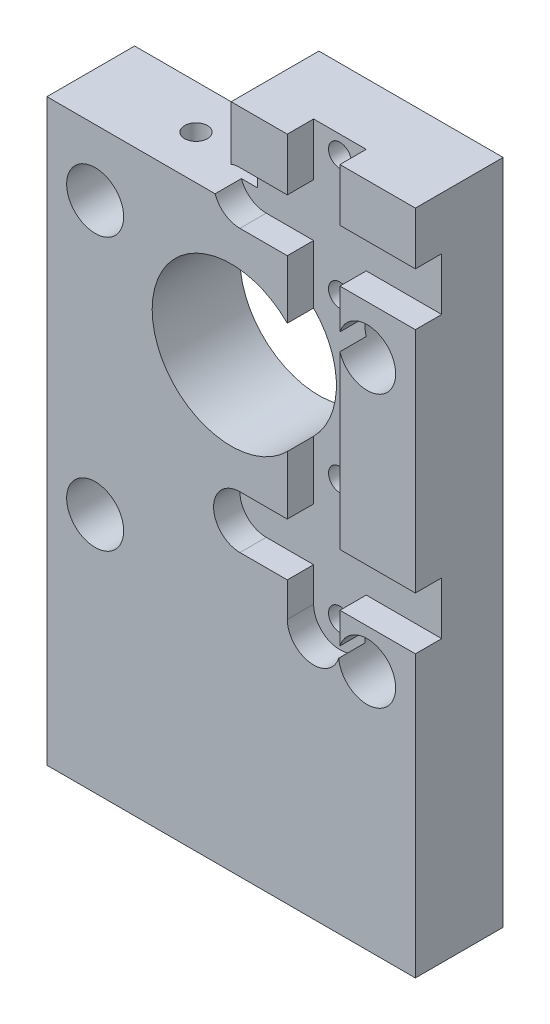
from build123d import *

# Parameters (mm, degrees)
BOSS_EXTRUDE1_DEPTH                      = 10
CUT_EXTRUDE1_REACH                       = 89.407
SKETCH2_R                                = 9
CUT_EXTRUDE2_DEPTH                       = 3
CBORE_FOR_M3_PAN_HEAD_SCREW1_D           = 3.4
CBORE_FOR_M3_PAN_HEAD_SCREW1_CBORE_D     = 6.5
CBORE_FOR_M3_PAN_HEAD_SCREW1_CBORE_DEPTH = 6.5
M3X0_5_TAPPED_HOLE1_D                    = 2.6
M3X0_5_TAPPED_HOLE2_D                    = 2.6
M3X0_5_TAPPED_HOLE2_DEPTH                = 9
M3X0_5_TAPPED_HOLE2_TIP                  = 0.781118805
M3X0_5_TAPPED_HOLE3_D                    = 2.6
M3X0_5_TAPPED_HOLE3_DEPTH                = 9
M3X0_5_TAPPED_HOLE3_TIP                  = 0.781118805


with BuildPart() as part:
    # Sketch1 → Boss-Extrude1 (new body)
    with BuildSketch(Plane.XY):
        Polygon((0, 0), (42, 0), (42, 66), (42, 76), (21, 76), (21, 66), (0, 66), align=None)
    extrude(amount=BOSS_EXTRUDE1_DEPTH)

    # Sketch2 → Cut-Extrude1 (cut, up to next)
    with BuildSketch(Plane.XY.offset(10), mode=Mode.PRIVATE) as cut_extrude1_sk1:
        with Locations((21, 51)):
            Circle(SKETCH2_R)
    cut_extrude1_tool1 = extrude(cut_extrude1_sk1.sketch, amount=-CUT_EXTRUDE1_REACH, mode=Mode.PRIVATE) & part.part
    add(cut_extrude1_tool1.solids().sort_by_distance((21, 51, 10))[0], mode=Mode.SUBTRACT)

    # Sketch3 → Cut-Extrude2 (cut)
    with BuildSketch(Plane.XY.offset(10)):
        with BuildLine():
            Line((27.4, 32), (27.4, 28.1))
            ThreePointArc((27.4, 28.1), (30.4, 25.1), (33.4, 28.1))
            Line((33.4, 28.1), (33.4, 32))
            Line((33.4, 32), (42, 32))
            Line((42, 32), (42, 38))
            Line((42, 38), (33.4, 38))
            Line((33.4, 38), (33.4, 64))
            Line((33.4, 64), (42, 64))
            Line((42, 64), (42, 70))
            Line((42, 70), (33.4, 70))
            Line((33.4, 70), (33.4, 76))
            Line((33.4, 76), (27.4, 76))
            Line((27.4, 76), (27.4, 70))
            Line((27.4, 70), (22, 70))
            ThreePointArc((22, 70), (19, 67), (22, 64))
            Line((22, 64), (27.4, 64))
            Line((27.4, 64), (27.4, 38))
            Line((27.4, 38), (22, 38))
            ThreePointArc((22, 38), (19, 35), (22, 32))
            Line((22, 32), (27.4, 32))
        make_face()
    extrude(amount=-CUT_EXTRUDE2_DEPTH, mode=Mode.SUBTRACT)

    # CBORE for M3 Pan Head Screw1 (through all)
    with Locations(Plane.XY.offset(10)):
        with Locations((5.5, 58.5), (36.5, 58.5), (5.5, 27.5), (36.5, 27.5)):
            CounterBoreHole(CBORE_FOR_M3_PAN_HEAD_SCREW1_D / 2, CBORE_FOR_M3_PAN_HEAD_SCREW1_CBORE_D / 2, CBORE_FOR_M3_PAN_HEAD_SCREW1_CBORE_DEPTH)

    # M3x0.5 Tapped Hole1 (through all)
    with Locations(Plane.XY.offset(7)):
        with Locations((30.4, 73.9), (30.4, 60.1), (30.4, 41.9), (30.4, 28.1)):
            Hole(M3X0_5_TAPPED_HOLE1_D / 2)

    # M3x0.5 Tapped Hole2
    with Locations(Plane(origin=(0, 0, 0), x_dir=(-1, 0, 0), z_dir=(0, -1, 0))):
        with Locations((-10, -5), (-32, -5)):
            Hole(M3X0_5_TAPPED_HOLE2_D / 2, depth=M3X0_5_TAPPED_HOLE2_DEPTH)
            with Locations((0, 0, -(M3X0_5_TAPPED_HOLE2_DEPTH + M3X0_5_TAPPED_HOLE2_TIP / 2))):  # 118° drill point
                Cone(0, M3X0_5_TAPPED_HOLE2_D / 2, M3X0_5_TAPPED_HOLE2_TIP, mode=Mode.SUBTRACT)

    # M3x0.5 Tapped Hole3
    with Locations(Plane(origin=(0, 66, 0), x_dir=(1, 0, 0), z_dir=(0, 1, 0))):
        with Locations((12, -5)):
            Hole(M3X0_5_TAPPED_HOLE3_D / 2, depth=M3X0_5_TAPPED_HOLE3_DEPTH)
            with Locations((0, 0, -(M3X0_5_TAPPED_HOLE3_DEPTH + M3X0_5_TAPPED_HOLE3_TIP / 2))):  # 118° drill point
                Cone(0, M3X0_5_TAPPED_HOLE3_D / 2, M3X0_5_TAPPED_HOLE3_TIP, mode=Mode.SUBTRACT)


solid = part.part
